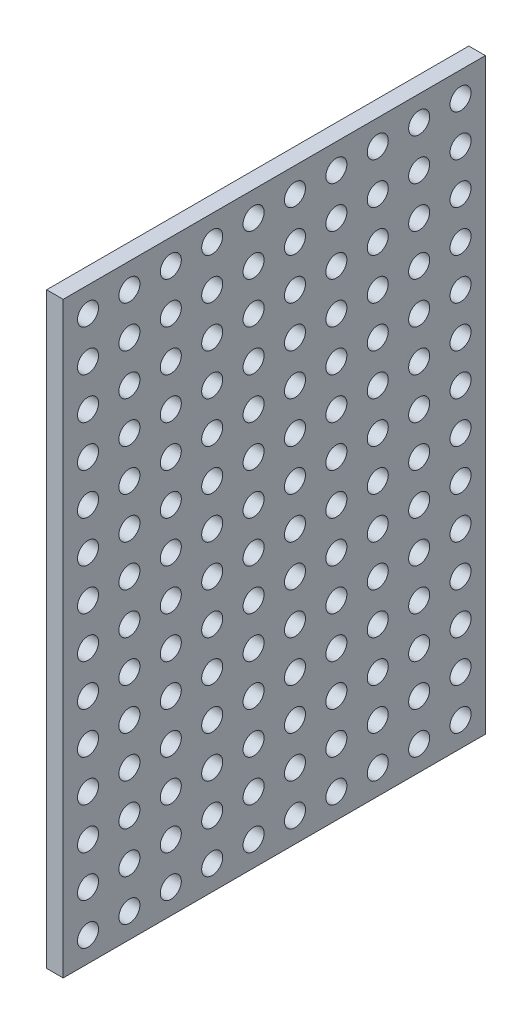
from build123d import *

# Parameters (mm, degrees)
SKETCH1_W           = 25.5
SKETCH1_H           = 35.5
SKETCH1_R           = 0.635
BOSS_EXTRUDE1_DEPTH = 1


with BuildPart() as part:
    # Sketch1 → Boss-Extrude1 (new body)
    with BuildSketch(Plane(origin=(0, 0, 0), x_dir=(0, 0, -1), z_dir=(1, 0, 0))):
        with Locations((12.75, 17.75)):
            Rectangle(SKETCH1_W, SKETCH1_H)
        with Locations((1.5, 34)):
            Circle(SKETCH1_R, mode=Mode.SUBTRACT)
        with Locations((4, 34)):
            Circle(SKETCH1_R, mode=Mode.SUBTRACT)
        with Locations((6.5, 34)):
            Circle(SKETCH1_R, mode=Mode.SUBTRACT)
        with Locations((9, 34)):
            Circle(SKETCH1_R, mode=Mode.SUBTRACT)
        with Locations((11.5, 34)):
            Circle(SKETCH1_R, mode=Mode.SUBTRACT)
        with Locations((14, 34)):
            Circle(SKETCH1_R, mode=Mode.SUBTRACT)
        with Locations((16.5, 34)):
            Circle(SKETCH1_R, mode=Mode.SUBTRACT)
        with Locations((19, 34)):
            Circle(SKETCH1_R, mode=Mode.SUBTRACT)
        with Locations((21.5, 34)):
            Circle(SKETCH1_R, mode=Mode.SUBTRACT)
        with Locations((24, 34)):
            Circle(SKETCH1_R, mode=Mode.SUBTRACT)
        with Locations((4, 31.5)):
            Circle(SKETCH1_R, mode=Mode.SUBTRACT)
        with Locations((6.5, 31.5)):
            Circle(SKETCH1_R, mode=Mode.SUBTRACT)
        with Locations((9, 31.5)):
            Circle(SKETCH1_R, mode=Mode.SUBTRACT)
        with Locations((11.5, 31.5)):
            Circle(SKETCH1_R, mode=Mode.SUBTRACT)
        with Locations((14, 31.5)):
            Circle(SKETCH1_R, mode=Mode.SUBTRACT)
        with Locations((16.5, 31.5)):
            Circle(SKETCH1_R, mode=Mode.SUBTRACT)
        with Locations((19, 31.5)):
            Circle(SKETCH1_R, mode=Mode.SUBTRACT)
        with Locations((21.5, 31.5)):
            Circle(SKETCH1_R, mode=Mode.SUBTRACT)
        with Locations((24, 31.5)):
            Circle(SKETCH1_R, mode=Mode.SUBTRACT)
        with Locations((4, 29)):
            Circle(SKETCH1_R, mode=Mode.SUBTRACT)
        with Locations((6.5, 29)):
            Circle(SKETCH1_R, mode=Mode.SUBTRACT)
        with Locations((9, 29)):
            Circle(SKETCH1_R, mode=Mode.SUBTRACT)
        with Locations((11.5, 29)):
            Circle(SKETCH1_R, mode=Mode.SUBTRACT)
        with Locations((14, 29)):
            Circle(SKETCH1_R, mode=Mode.SUBTRACT)
        with Locations((16.5, 29)):
            Circle(SKETCH1_R, mode=Mode.SUBTRACT)
        with Locations((19, 29)):
            Circle(SKETCH1_R, mode=Mode.SUBTRACT)
        with Locations((21.5, 29)):
            Circle(SKETCH1_R, mode=Mode.SUBTRACT)
        with Locations((24, 29)):
            Circle(SKETCH1_R, mode=Mode.SUBTRACT)
        with Locations((4, 26.5)):
            Circle(SKETCH1_R, mode=Mode.SUBTRACT)
        with Locations((6.5, 26.5)):
            Circle(SKETCH1_R, mode=Mode.SUBTRACT)
        with Locations((9, 26.5)):
            Circle(SKETCH1_R, mode=Mode.SUBTRACT)
        with Locations((11.5, 26.5)):
            Circle(SKETCH1_R, mode=Mode.SUBTRACT)
        with Locations((14, 26.5)):
            Circle(SKETCH1_R, mode=Mode.SUBTRACT)
        with Locations((16.5, 26.5)):
            Circle(SKETCH1_R, mode=Mode.SUBTRACT)
        with Locations((19, 26.5)):
            Circle(SKETCH1_R, mode=Mode.SUBTRACT)
        with Locations((21.5, 26.5)):
            Circle(SKETCH1_R, mode=Mode.SUBTRACT)
        with Locations((24, 26.5)):
            Circle(SKETCH1_R, mode=Mode.SUBTRACT)
        with Locations((4, 24)):
            Circle(SKETCH1_R, mode=Mode.SUBTRACT)
        with Locations((6.5, 24)):
            Circle(SKETCH1_R, mode=Mode.SUBTRACT)
        with Locations((9, 24)):
            Circle(SKETCH1_R, mode=Mode.SUBTRACT)
        with Locations((11.5, 24)):
            Circle(SKETCH1_R, mode=Mode.SUBTRACT)
        with Locations((14, 24)):
            Circle(SKETCH1_R, mode=Mode.SUBTRACT)
        with Locations((16.5, 24)):
            Circle(SKETCH1_R, mode=Mode.SUBTRACT)
        with Locations((19, 24)):
            Circle(SKETCH1_R, mode=Mode.SUBTRACT)
        with Locations((21.5, 24)):
            Circle(SKETCH1_R, mode=Mode.SUBTRACT)
        with Locations((24, 24)):
            Circle(SKETCH1_R, mode=Mode.SUBTRACT)
        with Locations((4, 21.5)):
            Circle(SKETCH1_R, mode=Mode.SUBTRACT)
        with Locations((6.5, 21.5)):
            Circle(SKETCH1_R, mode=Mode.SUBTRACT)
        with Locations((9, 21.5)):
            Circle(SKETCH1_R, mode=Mode.SUBTRACT)
        with Locations((11.5, 21.5)):
            Circle(SKETCH1_R, mode=Mode.SUBTRACT)
        with Locations((14, 21.5)):
            Circle(SKETCH1_R, mode=Mode.SUBTRACT)
        with Locations((16.5, 21.5)):
            Circle(SKETCH1_R, mode=Mode.SUBTRACT)
        with Locations((19, 21.5)):
            Circle(SKETCH1_R, mode=Mode.SUBTRACT)
        with Locations((21.5, 21.5)):
            Circle(SKETCH1_R, mode=Mode.SUBTRACT)
        with Locations((24, 21.5)):
            Circle(SKETCH1_R, mode=Mode.SUBTRACT)
        with Locations((4, 19)):
            Circle(SKETCH1_R, mode=Mode.SUBTRACT)
        with Locations((6.5, 19)):
            Circle(SKETCH1_R, mode=Mode.SUBTRACT)
        with Locations((9, 19)):
            Circle(SKETCH1_R, mode=Mode.SUBTRACT)
        with Locations((11.5, 19)):
            Circle(SKETCH1_R, mode=Mode.SUBTRACT)
        with Locations((14, 19)):
            Circle(SKETCH1_R, mode=Mode.SUBTRACT)
        with Locations((16.5, 19)):
            Circle(SKETCH1_R, mode=Mode.SUBTRACT)
        with Locations((19, 19)):
            Circle(SKETCH1_R, mode=Mode.SUBTRACT)
        with Locations((21.5, 19)):
            Circle(SKETCH1_R, mode=Mode.SUBTRACT)
        with Locations((24, 19)):
            Circle(SKETCH1_R, mode=Mode.SUBTRACT)
        with Locations((4, 16.5)):
            Circle(SKETCH1_R, mode=Mode.SUBTRACT)
        with Locations((6.5, 16.5)):
            Circle(SKETCH1_R, mode=Mode.SUBTRACT)
        with Locations((9, 16.5)):
            Circle(SKETCH1_R, mode=Mode.SUBTRACT)
        with Locations((11.5, 16.5)):
            Circle(SKETCH1_R, mode=Mode.SUBTRACT)
        with Locations((14, 16.5)):
            Circle(SKETCH1_R, mode=Mode.SUBTRACT)
        with Locations((16.5, 16.5)):
            Circle(SKETCH1_R, mode=Mode.SUBTRACT)
        with Locations((19, 16.5)):
            Circle(SKETCH1_R, mode=Mode.SUBTRACT)
        with Locations((21.5, 16.5)):
            Circle(SKETCH1_R, mode=Mode.SUBTRACT)
        with Locations((24, 16.5)):
            Circle(SKETCH1_R, mode=Mode.SUBTRACT)
        with Locations((4, 14)):
            Circle(SKETCH1_R, mode=Mode.SUBTRACT)
        with Locations((6.5, 14)):
            Circle(SKETCH1_R, mode=Mode.SUBTRACT)
        with Locations((9, 14)):
            Circle(SKETCH1_R, mode=Mode.SUBTRACT)
        with Locations((11.5, 14)):
            Circle(SKETCH1_R, mode=Mode.SUBTRACT)
        with Locations((14, 14)):
            Circle(SKETCH1_R, mode=Mode.SUBTRACT)
        with Locations((16.5, 14)):
            Circle(SKETCH1_R, mode=Mode.SUBTRACT)
        with Locations((19, 14)):
            Circle(SKETCH1_R, mode=Mode.SUBTRACT)
        with Locations((21.5, 14)):
            Circle(SKETCH1_R, mode=Mode.SUBTRACT)
        with Locations((24, 14)):
            Circle(SKETCH1_R, mode=Mode.SUBTRACT)
        with Locations((4, 11.5)):
            Circle(SKETCH1_R, mode=Mode.SUBTRACT)
        with Locations((6.5, 11.5)):
            Circle(SKETCH1_R, mode=Mode.SUBTRACT)
        with Locations((9, 11.5)):
            Circle(SKETCH1_R, mode=Mode.SUBTRACT)
        with Locations((11.5, 11.5)):
            Circle(SKETCH1_R, mode=Mode.SUBTRACT)
        with Locations((14, 11.5)):
            Circle(SKETCH1_R, mode=Mode.SUBTRACT)
        with Locations((16.5, 11.5)):
            Circle(SKETCH1_R, mode=Mode.SUBTRACT)
        with Locations((19, 11.5)):
            Circle(SKETCH1_R, mode=Mode.SUBTRACT)
        with Locations((21.5, 11.5)):
            Circle(SKETCH1_R, mode=Mode.SUBTRACT)
        with Locations((24, 11.5)):
            Circle(SKETCH1_R, mode=Mode.SUBTRACT)
        with Locations((4, 9)):
            Circle(SKETCH1_R, mode=Mode.SUBTRACT)
        with Locations((6.5, 9)):
            Circle(SKETCH1_R, mode=Mode.SUBTRACT)
        with Locations((9, 9)):
            Circle(SKETCH1_R, mode=Mode.SUBTRACT)
        with Locations((11.5, 9)):
            Circle(SKETCH1_R, mode=Mode.SUBTRACT)
        with Locations((14, 9)):
            Circle(SKETCH1_R, mode=Mode.SUBTRACT)
        with Locations((16.5, 9)):
            Circle(SKETCH1_R, mode=Mode.SUBTRACT)
        with Locations((19, 9)):
            Circle(SKETCH1_R, mode=Mode.SUBTRACT)
        with Locations((21.5, 9)):
            Circle(SKETCH1_R, mode=Mode.SUBTRACT)
        with Locations((24, 9)):
            Circle(SKETCH1_R, mode=Mode.SUBTRACT)
        with Locations((4, 6.5)):
            Circle(SKETCH1_R, mode=Mode.SUBTRACT)
        with Locations((6.5, 6.5)):
            Circle(SKETCH1_R, mode=Mode.SUBTRACT)
        with Locations((9, 6.5)):
            Circle(SKETCH1_R, mode=Mode.SUBTRACT)
        with Locations((11.5, 6.5)):
            Circle(SKETCH1_R, mode=Mode.SUBTRACT)
        with Locations((14, 6.5)):
            Circle(SKETCH1_R, mode=Mode.SUBTRACT)
        with Locations((16.5, 6.5)):
            Circle(SKETCH1_R, mode=Mode.SUBTRACT)
        with Locations((19, 6.5)):
            Circle(SKETCH1_R, mode=Mode.SUBTRACT)
        with Locations((21.5, 6.5)):
            Circle(SKETCH1_R, mode=Mode.SUBTRACT)
        with Locations((24, 6.5)):
            Circle(SKETCH1_R, mode=Mode.SUBTRACT)
        with Locations((1.5, 31.5)):
            Circle(SKETCH1_R, mode=Mode.SUBTRACT)
        with Locations((1.5, 29)):
            Circle(SKETCH1_R, mode=Mode.SUBTRACT)
        with Locations((1.5, 26.5)):
            Circle(SKETCH1_R, mode=Mode.SUBTRACT)
        with Locations((1.5, 24)):
            Circle(SKETCH1_R, mode=Mode.SUBTRACT)
        with Locations((1.5, 21.5)):
            Circle(SKETCH1_R, mode=Mode.SUBTRACT)
        with Locations((1.5, 19)):
            Circle(SKETCH1_R, mode=Mode.SUBTRACT)
        with Locations((1.5, 16.5)):
            Circle(SKETCH1_R, mode=Mode.SUBTRACT)
        with Locations((1.5, 14)):
            Circle(SKETCH1_R, mode=Mode.SUBTRACT)
        with Locations((1.5, 11.5)):
            Circle(SKETCH1_R, mode=Mode.SUBTRACT)
        with Locations((1.5, 9)):
            Circle(SKETCH1_R, mode=Mode.SUBTRACT)
        with Locations((1.5, 6.5)):
            Circle(SKETCH1_R, mode=Mode.SUBTRACT)
        with Locations((1.5, 4)):
            Circle(SKETCH1_R, mode=Mode.SUBTRACT)
        with Locations((4, 4)):
            Circle(SKETCH1_R, mode=Mode.SUBTRACT)
        with Locations((6.5, 4)):
            Circle(SKETCH1_R, mode=Mode.SUBTRACT)
        with Locations((9, 4)):
            Circle(SKETCH1_R, mode=Mode.SUBTRACT)
        with Locations((11.5, 4)):
            Circle(SKETCH1_R, mode=Mode.SUBTRACT)
        with Locations((14, 4)):
            Circle(SKETCH1_R, mode=Mode.SUBTRACT)
        with Locations((16.5, 4)):
            Circle(SKETCH1_R, mode=Mode.SUBTRACT)
        with Locations((19, 4)):
            Circle(SKETCH1_R, mode=Mode.SUBTRACT)
        with Locations((21.5, 4)):
            Circle(SKETCH1_R, mode=Mode.SUBTRACT)
        with Locations((24, 4)):
            Circle(SKETCH1_R, mode=Mode.SUBTRACT)
        with Locations((1.5, 1.5)):
            Circle(SKETCH1_R, mode=Mode.SUBTRACT)
        with Locations((4, 1.5)):
            Circle(SKETCH1_R, mode=Mode.SUBTRACT)
        with Locations((6.5, 1.5)):
            Circle(SKETCH1_R, mode=Mode.SUBTRACT)
        with Locations((9, 1.5)):
            Circle(SKETCH1_R, mode=Mode.SUBTRACT)
        with Locations((11.5, 1.5)):
            Circle(SKETCH1_R, mode=Mode.SUBTRACT)
        with Locations((14, 1.5)):
            Circle(SKETCH1_R, mode=Mode.SUBTRACT)
        with Locations((16.5, 1.5)):
            Circle(SKETCH1_R, mode=Mode.SUBTRACT)
        with Locations((19, 1.5)):
            Circle(SKETCH1_R, mode=Mode.SUBTRACT)
        with Locations((21.5, 1.5)):
            Circle(SKETCH1_R, mode=Mode.SUBTRACT)
        with Locations((24, 1.5)):
            Circle(SKETCH1_R, mode=Mode.SUBTRACT)
    extrude(amount=BOSS_EXTRUDE1_DEPTH)


solid = part.part
